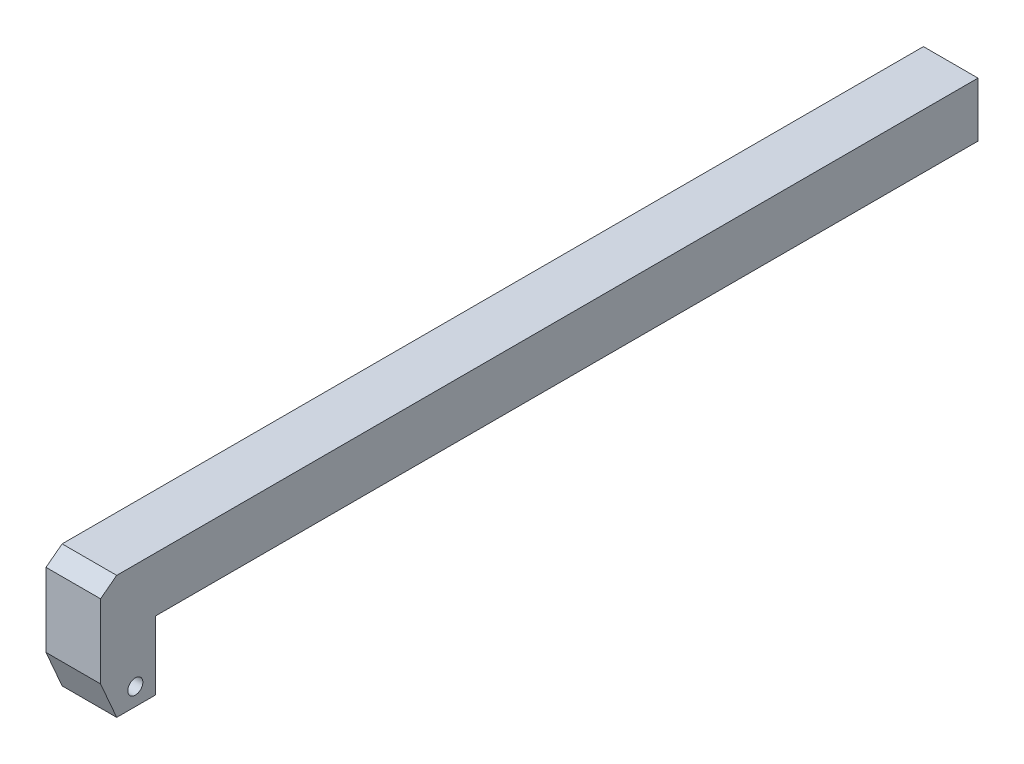
from build123d import *

# Parameters (mm, degrees)
SKETCH2_W           = 736.6
SKETCH2_H           = 736.6
BOSS_EXTRUDE1_DEPTH = 11099.8
SKETCH3_R           = 101.6
BOSS_EXTRUDE2_DEPTH = 736.6


with BuildPart() as part:
    # Sketch2 → Boss-Extrude1 (new body)
    with BuildSketch(Plane.XY):
        with Locations((368.3, 368.3)):
            Rectangle(SKETCH2_W, SKETCH2_H)
    extrude(amount=BOSS_EXTRUDE1_DEPTH)

    # Sketch3 → Boss-Extrude2 (add)
    with BuildSketch(Plane(origin=(736.6, 0, 0), x_dir=(0, 0, -1), z_dir=(1, 0, 0))):
        Polygon((-11099.8, 736.6), (-11625.819203205, 736.6), (-11843.547005601, 571.270728239), (-11843.547005601, -423.59872011), (-11625.819203205, -923.877591133), (-11099.8, -923.877591133), (-11099.8, 0), align=None)
        with Locations((-11374.533737558, -687.797576453)):
            Circle(SKETCH3_R, mode=Mode.SUBTRACT)
    extrude(amount=-BOSS_EXTRUDE2_DEPTH)


solid = part.part
